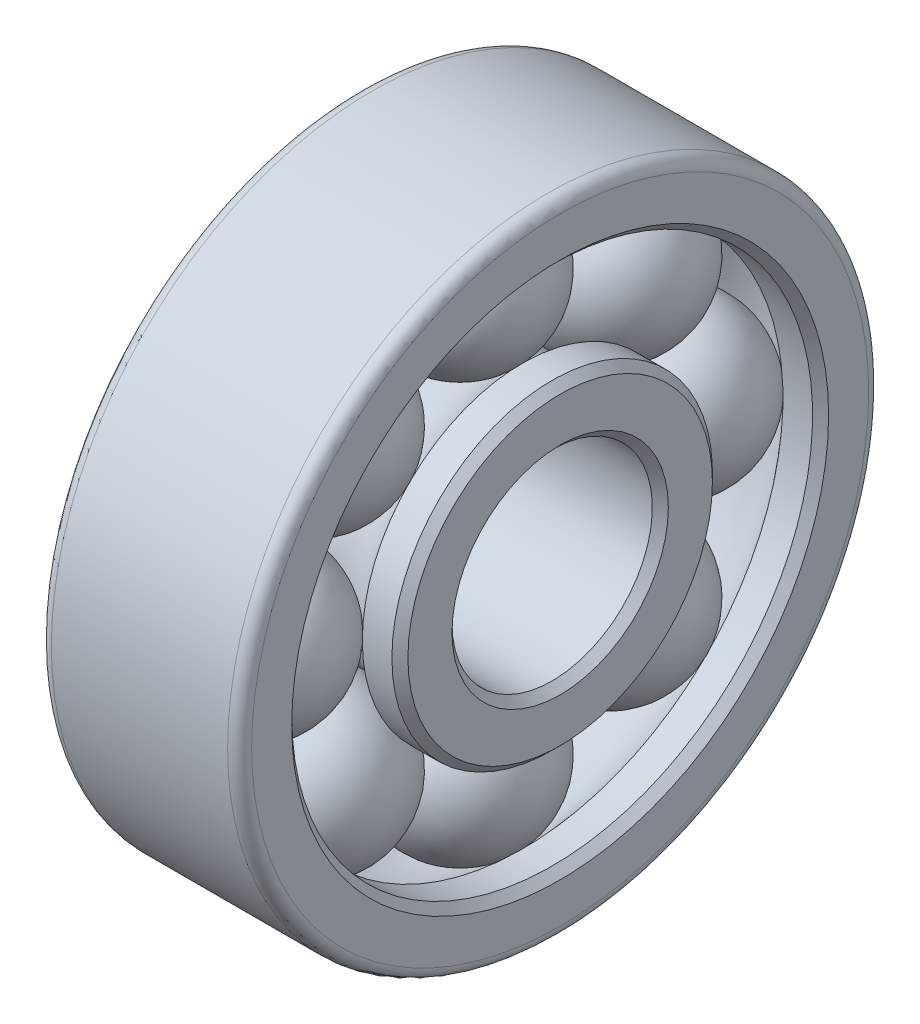
from build123d import *

# Parameters (mm, degrees)
PATTERN_CIRCULAR_5_COUNT = 8
FILLET_1_R               = 0.3
CHAMFER_1_SIZE           = 0.2
CHAMFER_2_SIZE           = 0.2


with BuildPart() as part:
    # Эскиз1 → Повернуть1 (revolve)
    with BuildSketch(Plane.XY, mode=Mode.PRIVATE) as revolve_1_sk:
        with BuildLine():
            Line((0, 0), (5, 0))
            Line((5, 0), (5, 1.5))
            Line((5, 1.5), (4.0612495, 1.5))
            ThreePointArc((4.0612495, 1.5), (2.5, 0.75), (0.9387505, 1.5))
            Line((0.9387505, 1.5), (0, 1.5))
            Line((0, 1.5), (0, 0))
        make_face()
        with BuildLine():
            Line((0, 4), (0.9387505, 4))
            ThreePointArc((0.9387505, 4), (2.5, 4.75), (4.0612495, 4))
            Line((4.0612495, 4), (5, 4))
            Line((5, 4), (5, 5.5))
            Line((5, 5.5), (0, 5.5))
            Line((0, 5.5), (0, 4))
        make_face()
    revolve(revolve_1_sk.sketch.rotate(Axis((-1.066901408, -2.5, 0), (1, 0, 0)), 90), axis=Axis((-1.066901408, -2.5, 0), (1, 0, 0)))

    # Скругление1
    fillet_1_edges = [part.edges().sort_by_distance(p)[0] for p in [
        (0, -2.5, -8),
        (5, -2.5, -8),
    ]]
    fillet(fillet_1_edges, radius=FILLET_1_R)

    # Фаска1
    chamfer_1_edges = [part.edges().sort_by_distance(p)[0] for p in [
        (0, -2.5, -4),
        (5, -2.5, -4),
        (5, -2.5, -2.5),
        (0, -2.5, -2.5),
    ]]
    chamfer(chamfer_1_edges, length=CHAMFER_1_SIZE)

    # Фаска2
    chamfer_2_edges = [part.edges().sort_by_distance(p)[0] for p in [
        (5, -2.5, -6.5),
        (0, -2.5, -6.5),
    ]]
    chamfer(chamfer_2_edges, length=CHAMFER_2_SIZE)


with BuildPart() as body_2:
    # Эскиз2 → Повернуть2 (revolve)
    with BuildSketch(Plane.XY):
        with BuildLine():
            Line((2.5, 4.75), (2.5, 0.75))
            ThreePointArc((2.5, 0.75), (0.5, 2.75), (2.5, 4.75))
        make_face()
    revolve(axis=Axis((2.5, 4.75, 0), (0, -1, 0)))


with BuildPart() as pattern_circular_5_1:
    # Круговой массив5: pattern copy
    add(body_2.part.rotate(Axis((0, -2.5, 0), (1, 0, 0)), 1 * 360 / PATTERN_CIRCULAR_5_COUNT))


with BuildPart() as pattern_circular_5_2:
    # Круговой массив5: pattern copy
    add(body_2.part.rotate(Axis((0, -2.5, 0), (1, 0, 0)), 2 * 360 / PATTERN_CIRCULAR_5_COUNT))


with BuildPart() as pattern_circular_5_3:
    # Круговой массив5: pattern copy
    add(body_2.part.rotate(Axis((0, -2.5, 0), (1, 0, 0)), 3 * 360 / PATTERN_CIRCULAR_5_COUNT))


with BuildPart() as pattern_circular_5_4:
    # Круговой массив5: pattern copy
    add(body_2.part.rotate(Axis((0, -2.5, 0), (1, 0, 0)), 4 * 360 / PATTERN_CIRCULAR_5_COUNT))


with BuildPart() as pattern_circular_5_5:
    # Круговой массив5: pattern copy
    add(body_2.part.rotate(Axis((0, -2.5, 0), (1, 0, 0)), 5 * 360 / PATTERN_CIRCULAR_5_COUNT))


with BuildPart() as pattern_circular_5_6:
    # Круговой массив5: pattern copy
    add(body_2.part.rotate(Axis((0, -2.5, 0), (1, 0, 0)), 6 * 360 / PATTERN_CIRCULAR_5_COUNT))


with BuildPart() as pattern_circular_5_7:
    # Круговой массив5: pattern copy
    add(body_2.part.rotate(Axis((0, -2.5, 0), (1, 0, 0)), 7 * 360 / PATTERN_CIRCULAR_5_COUNT))


solid = Compound([part.part, body_2.part, pattern_circular_5_1.part, pattern_circular_5_2.part, pattern_circular_5_3.part, pattern_circular_5_4.part, pattern_circular_5_5.part, pattern_circular_5_6.part, pattern_circular_5_7.part])
